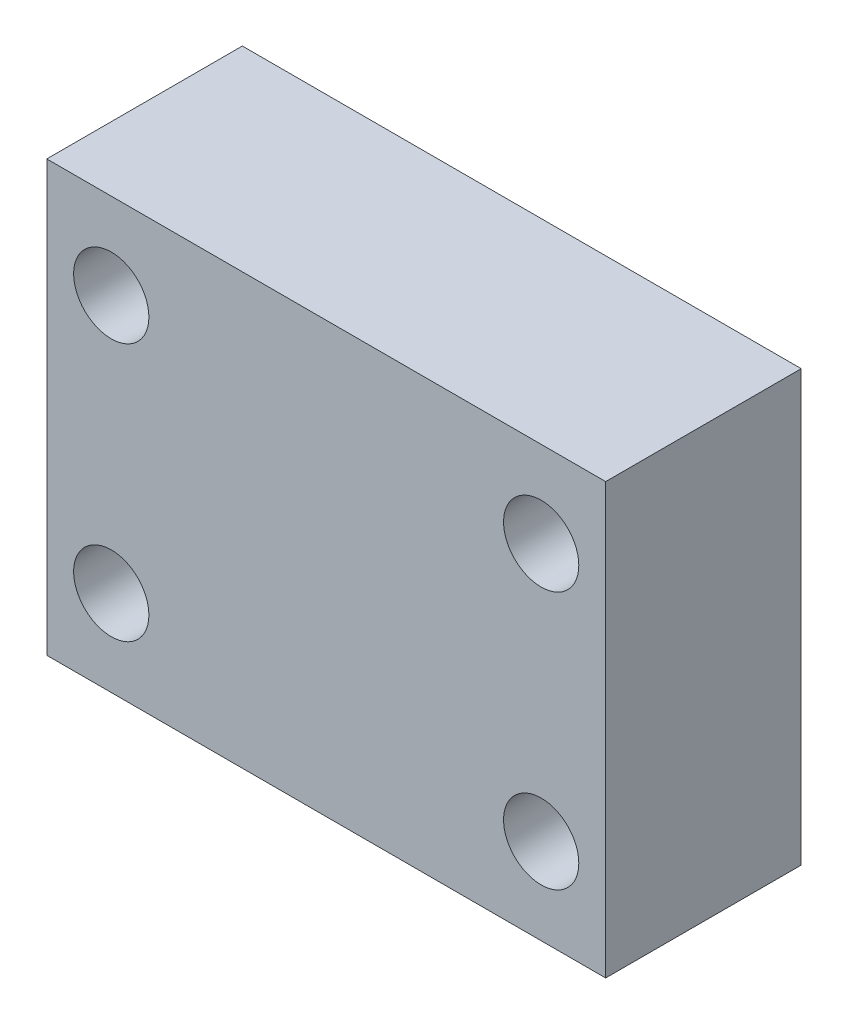
from build123d import *

# Parameters (mm, degrees)
SKETCH1_W           = 52
SKETCH1_H           = 40
SKETCH1_R           = 3.5
BOSS_EXTRUDE1_DEPTH = 18.19490677


with BuildPart() as part:
    # Sketch1 → Boss-Extrude1 (new body)
    with BuildSketch(Plane.XY):
        with Locations((26, -20)):
            Rectangle(SKETCH1_W, SKETCH1_H)
        with Locations((6, -8)):
            Circle(SKETCH1_R, mode=Mode.SUBTRACT)
        with Locations((46, -8)):
            Circle(SKETCH1_R, mode=Mode.SUBTRACT)
        with Locations((6, -32)):
            Circle(SKETCH1_R, mode=Mode.SUBTRACT)
        with Locations((46, -32)):
            Circle(SKETCH1_R, mode=Mode.SUBTRACT)
    extrude(amount=BOSS_EXTRUDE1_DEPTH)


solid = part.part
